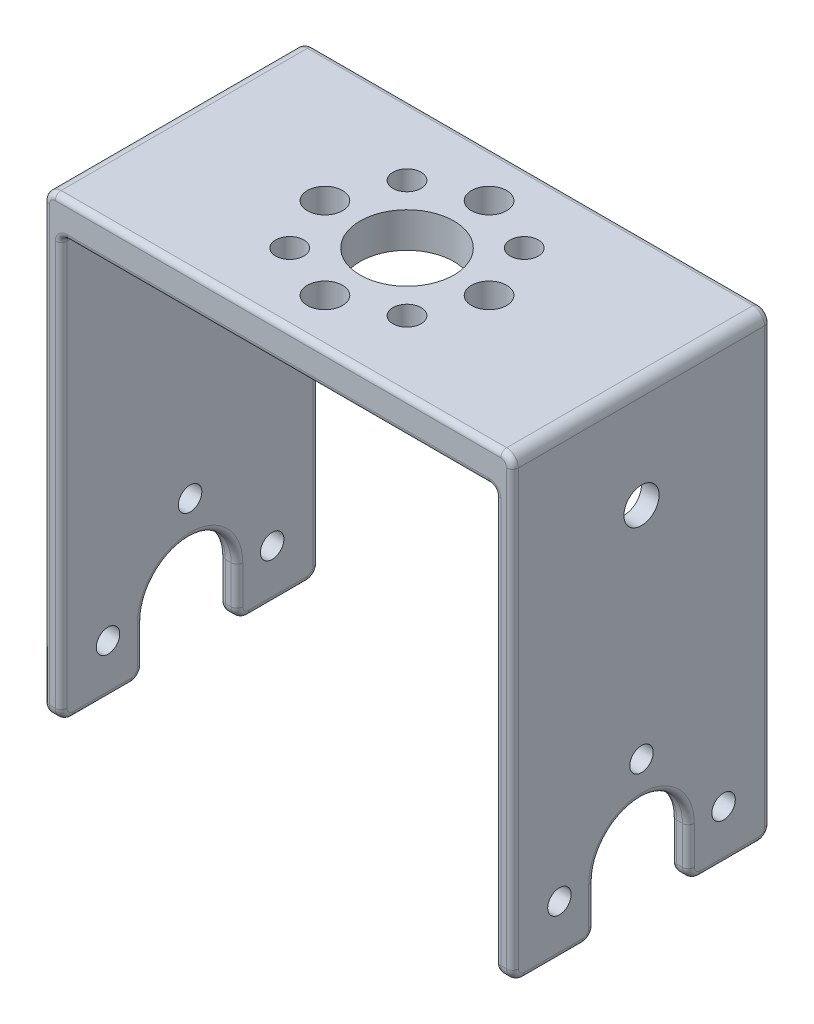
from build123d import *

# Parameters (mm, degrees)
SKETCH1_W           = 40
SKETCH1_H           = 22
SKETCH1_R           = 4
SKETCH1_R_2         = 1.5
SKETCH1_R_3         = 1.2
BOSS_EXTRUDE1_DEPTH = 3
SKETCH2_W           = 1.5
SKETCH2_H           = 22
BOSS_EXTRUDE2_DEPTH = 36
FILLET1_R           = 1
SKETCH3_R           = 1.5
SKETCH3_R_2         = 1
CUT_EXTRUDE1_DEPTH  = 55.927224579
FILLET2_R           = 1
FILLET_1_R          = 0.5


with BuildPart() as part:
    # Sketch1 → Boss-Extrude1 (new body)
    with BuildSketch(Plane(origin=(0, 0, 0), x_dir=(1, 0, 0), z_dir=(0, 1, 0))):
        Rectangle(SKETCH1_W, SKETCH1_H)
        with Locations(Location((0, 0, 0), (0, 0, 270))):
            Circle(SKETCH1_R, mode=Mode.SUBTRACT)
        with Locations(Location((0, 7, 0), (0, 0, 270))):
            Circle(SKETCH1_R_2, mode=Mode.SUBTRACT)
        with Locations(Location((7, 0, 0), (0, 0, 270))):
            Circle(SKETCH1_R_2, mode=Mode.SUBTRACT)
        with Locations(Location((0, -7, 0), (0, 0, 270))):
            Circle(SKETCH1_R_2, mode=Mode.SUBTRACT)
        with Locations(Location((-7, 0, 0), (0, 0, 270))):
            Circle(SKETCH1_R_2, mode=Mode.SUBTRACT)
        with Locations(Location((5, 5, 0), (0, 0, 270))):
            Circle(SKETCH1_R_3, mode=Mode.SUBTRACT)
        with Locations(Location((5, -5, 0), (0, 0, 270))):
            Circle(SKETCH1_R_3, mode=Mode.SUBTRACT)
        with Locations(Location((-5, -5, 0), (0, 0, 270))):
            Circle(SKETCH1_R_3, mode=Mode.SUBTRACT)
        with Locations(Location((-5, 5, 0), (0, 0, 270))):
            Circle(SKETCH1_R_3, mode=Mode.SUBTRACT)
    extrude(amount=BOSS_EXTRUDE1_DEPTH)

    # Sketch2 → Boss-Extrude2 (add)
    with BuildSketch(Plane(origin=(0, 0, 0), x_dir=(-1, 0, 0), z_dir=(0, -1, 0))):
        with Locations((-19.25, 0)):
            Rectangle(SKETCH2_W, SKETCH2_H)
    boss_extrude2 = extrude(amount=BOSS_EXTRUDE2_DEPTH)

    # Mirror1: Boss-Extrude2 across plane
    add(boss_extrude2.mirror(Plane(origin=(0, 0, 0), x_dir=(0, 0, 1), z_dir=(1, 0, 0))))

    # Fillet1
    fillet1_edges = [part.edges().sort_by_distance(p)[0] for p in [
        (-20, 3, 0),
        (20, 3, 0),
    ]]
    fillet(fillet1_edges, radius=FILLET1_R)

    # Sketch3 → Cut-Extrude1 (cut, through all)
    with BuildSketch(Plane.ZY.offset(20)):
        with Locations((0, -6)):
            Circle(SKETCH3_R)
        with Locations((0, -24.75)):
            Circle(SKETCH3_R_2)
        with Locations((-7, -31.75)):
            Circle(SKETCH3_R_2)
        with Locations((7, -31.75)):
            Circle(SKETCH3_R_2)
        with BuildLine():
            Line((-4, -31.75), (-4, -36))
            Line((-4, -36), (4, -36))
            Line((4, -36), (4, -31.75))
            ThreePointArc((4, -31.75), (0, -27.75), (-4, -31.75))
        make_face()
    extrude(amount=-CUT_EXTRUDE1_DEPTH, mode=Mode.SUBTRACT)

    # Fillet2
    fillet2_edges = [part.edges().sort_by_distance(p)[0] for p in [
        (-19.25, -36, -4),
        (-19.25, -36, 4),
        (19.25, -36, 4),
        (19.25, -36, -4),
        (19.25, -36, 11),
        (19.25, -36, -11),
        (-19.25, -36, -11),
        (-19.25, -36, 11),
    ]]
    fillet(fillet2_edges, radius=FILLET2_R)

    # 圆角1
    fillet_1_edges = [part.edges().sort_by_distance(p)[0] for p in [
        (-18.5, -27.75, 0),
        (18.5, -27.75, 0),
        (20, -27.75, 0),
        (18.5, -33.375, 4),
        (-18.5, -33.375, 4),
        (20, -33.375, -4),
        (-20, -27.75, 0),
        (-20, -33.375, -4),
        (18.5, -17.5, -11),
        (-18.5, -17.5, -11),
        (-20, -33.375, 4),
        (-20, -36, 7.5),
        (-20, -36, -7.5),
        (-20, -35.707106781, 10.707106781),
        (-20, -35.707106781, 4.292893219),
        (-20, -35.707106781, -4.292893219),
        (-20, -35.707106781, -10.707106781),
        (-18.5, -36, -7.5),
        (-18.5, -33.375, -4),
        (-18.5, -17.5, 11),
        (-18.5, -36, 7.5),
        (-18.5, -35.707106781, 10.707106781),
        (-18.5, -35.707106781, 4.292893219),
        (-18.5, -35.707106781, -4.292893219),
        (-18.5, -35.707106781, -10.707106781),
        (18.5, -17.5, 11),
        (20, -36, 7.5),
        (18.5, -36, 7.5),
        (18.5, -36, -7.5),
        (18.5, -33.375, -4),
        (18.5, -35.707106781, -10.707106781),
        (18.5, -35.707106781, -4.292893219),
        (18.5, -35.707106781, 4.292893219),
        (18.5, -35.707106781, 10.707106781),
        (20, -33.375, 4),
        (20, -36, -7.5),
        (20, -35.707106781, -10.707106781),
        (20, -35.707106781, -4.292893219),
        (20, -35.707106781, 4.292893219),
        (20, -35.707106781, 10.707106781),
        (0, 0, -11),
        (18.5, 0, 0),
        (0, 0, 11),
        (-18.5, 0, 0),
        (0, 3, -11),
        (0, 3, 11),
        (20, -16.5, -11),
        (-20, -16.5, -11),
        (-19.707106781, 2.707106781, -11),
        (19.707106781, 2.707106781, -11),
        (20, -16.5, 11),
        (-20, -16.5, 11),
        (-19.707106781, 2.707106781, 11),
        (19.707106781, 2.707106781, 11),
    ]]
    fillet(fillet_1_edges, radius=FILLET_1_R)


solid = part.part
